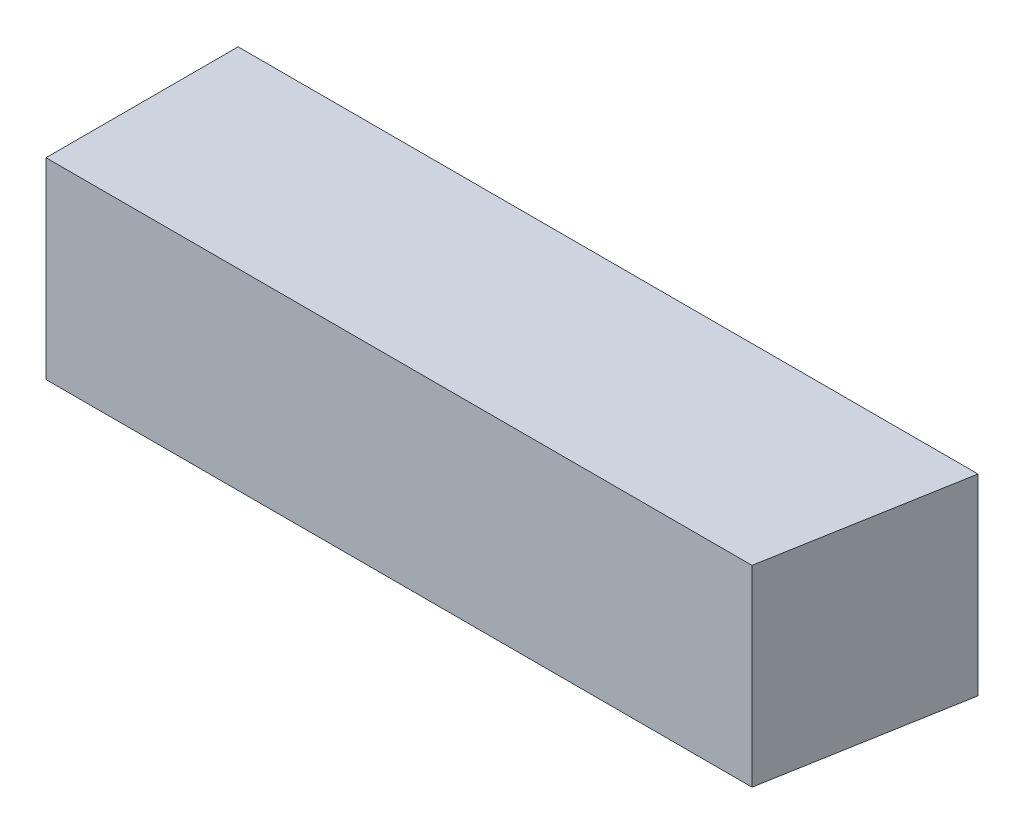
from build123d import *

# Parameters (mm, degrees)
SKETCH1_W           = 88.9
SKETCH1_H           = 88.9
BOSS_EXTRUDE1_DEPTH = 342.392
CUT_EXTRUDE1_DEPTH  = 88.9


with BuildPart() as part:
    # Sketch1 → Boss-Extrude1 (new body)
    with BuildSketch(Plane.YZ):
        with Locations((44.45, 44.45)):
            Rectangle(SKETCH1_W, SKETCH1_H)
    extrude(amount=BOSS_EXTRUDE1_DEPTH)

    # Sketch2 → Cut-Extrude1 (cut)
    with BuildSketch(Plane(origin=(0, 0, 0), x_dir=(-1, 0, 0), z_dir=(0, 1, 0))):
        Polygon((-342.392, 0), (-326.71893, 88.9), (-342.392, 88.9), align=None)
    extrude(amount=CUT_EXTRUDE1_DEPTH, mode=Mode.SUBTRACT)


solid = part.part
